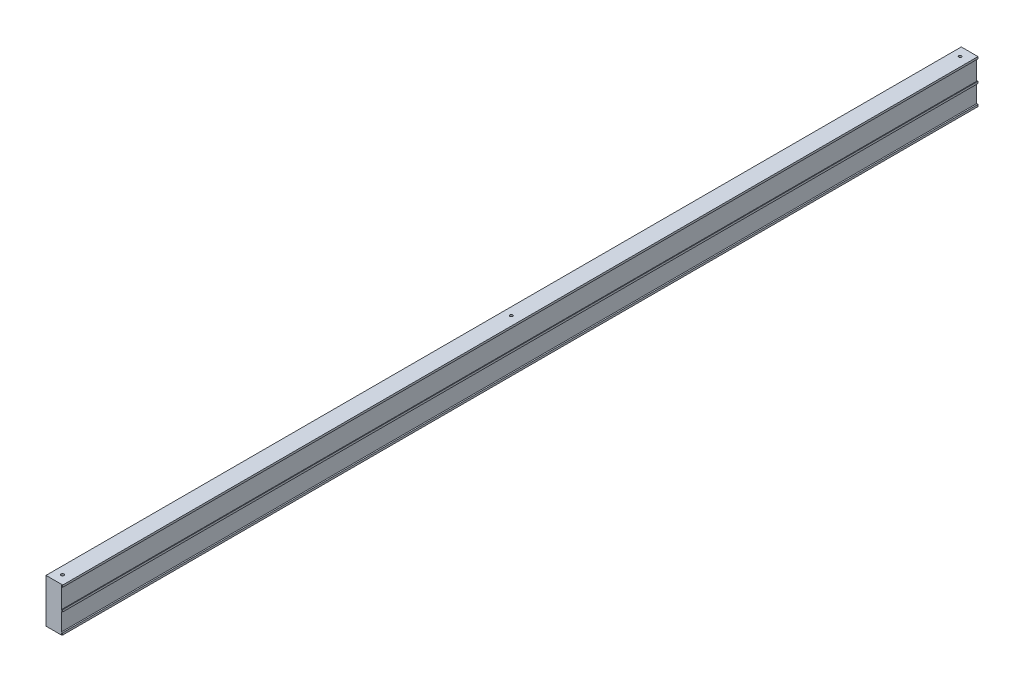
from build123d import *

# Parameters (mm, degrees)
SALIENTE_EXTRUIR1_DEPTH = 2080
CROQUIS2_R              = 3.175
CORTAR_EXTRUIR1_DEPTH   = 30


with BuildPart() as part:
    # Croquis1 → Saliente-Extruir1 (new body)
    with BuildSketch(Plane.XY):
        Polygon((17.5, 50), (20.5, 50), (20.5, 45.5), (19, 45.5), (19, 48.5), (17.5, 48.5), (17.5, -1.5), (19, -1.5), (19, 1.5), (20.5, 1.5), (20.5, -3), (17.5, -3), (17.5, -44), (20.5, -44), (20.5, -48.5), (19, -48.5), (19, -45.5), (17.5, -45.5), (17.5, -50), (-17.5, -50), (-17.5, 50), align=None)
    extrude(amount=SALIENTE_EXTRUIR1_DEPTH)

    # Croquis2 → Cortar-Extruir1 (cut)
    with BuildSketch(Plane(origin=(0, 50, 0), x_dir=(1, 0, 0), z_dir=(0, 1, 0))):
        with Locations(Location((0, -20, 0), (0, 0, 270))):
            Circle(CROQUIS2_R)
        with Locations(Location((0, -1040, 0), (0, 0, 270))):
            Circle(CROQUIS2_R)
        with Locations(Location((0, -2060, 0), (0, 0, 270))):
            Circle(CROQUIS2_R)
    extrude(amount=-CORTAR_EXTRUIR1_DEPTH, mode=Mode.SUBTRACT)


solid = part.part
